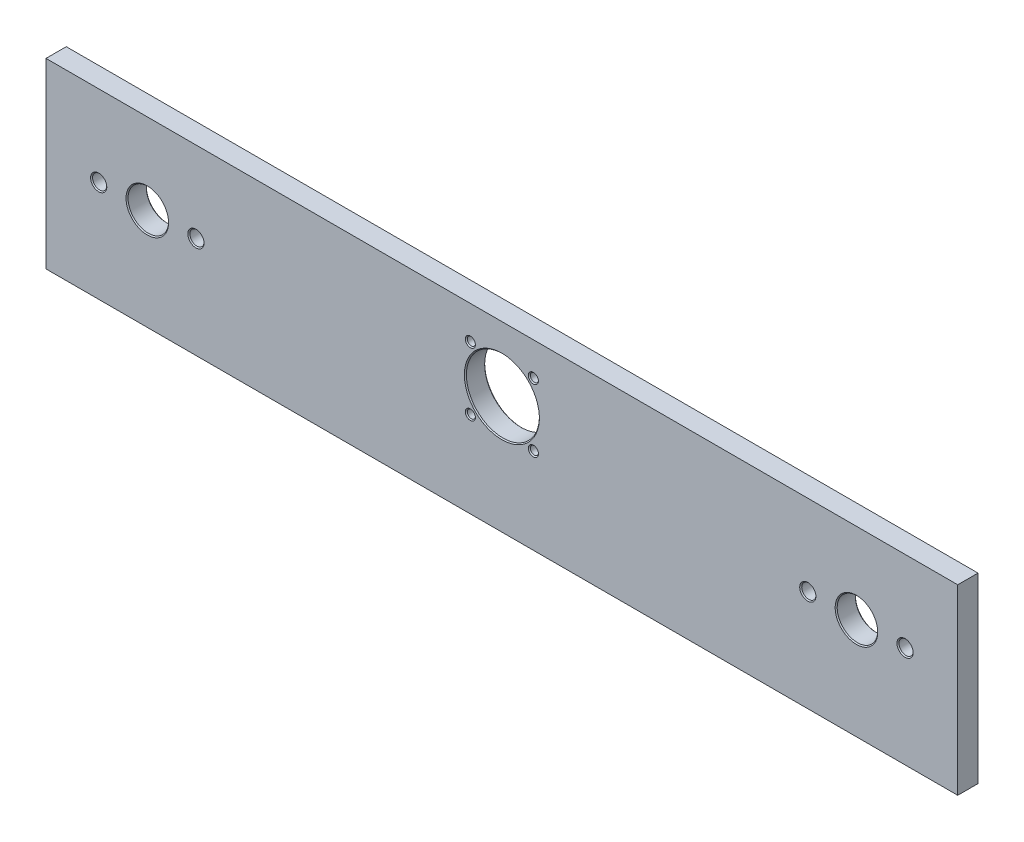
from build123d import *

# Parameters (mm, degrees)
CROQUIS2_W              = 450
CROQUIS2_H              = 90
SALIENTE_EXTRUIR1_DEPTH = 10
CROQUIS6_R              = 18
CROQUIS6_R_2            = 2
CORTAR_EXTRUIR1_DEPTH   = 460.020696701
CHAFL_N5_SIZE           = 0.5
CROQUIS9_R              = 10
CROQUIS9_R_2            = 3.5
CORTAR_EXTRUIR2_DEPTH   = 460.020696701
CHAFL_N6_SIZE           = 0.5


with BuildPart() as part:
    # Croquis2 → Saliente-Extruir1 (new body)
    with BuildSketch(Plane.XY):
        with Locations((225, 45)):
            Rectangle(CROQUIS2_W, CROQUIS2_H)
    extrude(amount=SALIENTE_EXTRUIR1_DEPTH)

    # Croquis6 → Cortar-Extruir1 (cut, through all)
    with BuildSketch(Plane.XY.offset(10)):
        with Locations((225, 58)):
            Circle(CROQUIS6_R)
        with Locations((209.437767177, 73.550463323)):
            Circle(CROQUIS6_R_2)
        with Locations((240.550463323, 73.562232823)):
            Circle(CROQUIS6_R_2)
        with Locations((240.562232823, 42.449536677)):
            Circle(CROQUIS6_R_2)
        with Locations((209.449536677, 42.437767177)):
            Circle(CROQUIS6_R_2)
    extrude(amount=-CORTAR_EXTRUIR1_DEPTH, mode=Mode.SUBTRACT)

    # Chaflán5
    chafl_n5_edges = [part.edges().sort_by_distance(p)[0] for p in [
        (207, 58, 0),
        (207, 58, 10),
        (207.437767177, 73.550463323, 0),
        (207.437767177, 73.550463323, 10),
        (238.550463323, 73.562232823, 0),
        (238.550463323, 73.562232823, 10),
        (238.562232823, 42.449536677, 0),
        (238.562232823, 42.449536677, 10),
        (207.449536677, 42.437767177, 0),
        (207.449536677, 42.437767177, 10),
    ]]
    chamfer(chafl_n5_edges, length=CHAFL_N5_SIZE)

    # Croquis9 → Cortar-Extruir2 (cut, through all)
    with BuildSketch(Plane.XY.offset(10)):
        with Locations((50, 50)):
            Circle(CROQUIS9_R)
        with Locations(Location((400, 50, 0), (0, 0, 180))):
            Circle(CROQUIS9_R)
        with Locations((26, 50)):
            Circle(CROQUIS9_R_2)
        with Locations((74, 50)):
            Circle(CROQUIS9_R_2)
        with Locations(Location((376, 50, 0), (0, 0, 180))):
            Circle(CROQUIS9_R_2)
        with Locations(Location((424, 50, 0), (0, 0, 180))):
            Circle(CROQUIS9_R_2)
    extrude(amount=-CORTAR_EXTRUIR2_DEPTH, mode=Mode.SUBTRACT)

    # Chaflán6
    chafl_n6_edges = [part.edges().sort_by_distance(p)[0] for p in [
        (40, 50, 0),
        (40, 50, 10),
        (410, 50, 0),
        (410, 50, 10),
        (22.5, 50, 0),
        (22.5, 50, 10),
        (70.5, 50, 0),
        (70.5, 50, 10),
        (379.5, 50, 0),
        (379.5, 50, 10),
        (427.5, 50, 0),
        (427.5, 50, 10),
    ]]
    chamfer(chafl_n6_edges, length=CHAFL_N6_SIZE)


solid = part.part
